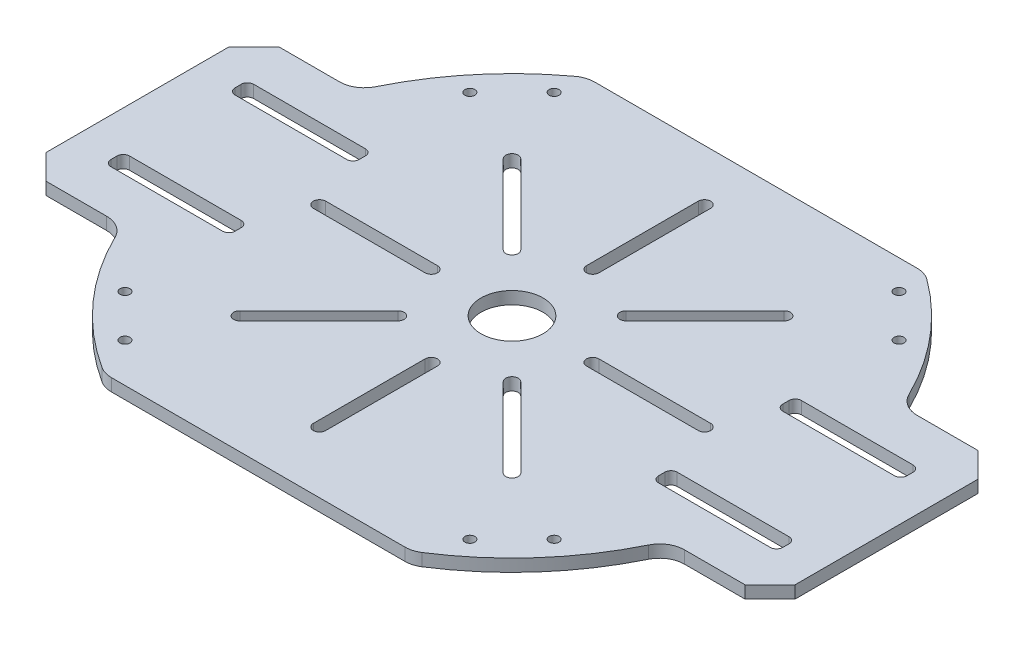
from build123d import *

# Parameters (mm, degrees)
SKETCH1_R           = 6.35
SKETCH1_R_2         = 1.016
SKETCH1_R_3         = 0.080960071
SKETCH1_R_4         = 0.080960069
SKETCH1_R_5         = 0.080960077
BOSS_EXTRUDE1_DEPTH = 2.54
CUT_EXTRUDE1_DEPTH  = 2.54
CUT_EXTRUDE2_DEPTH  = 2.54


with BuildPart() as part:
    # Sketch1 → Boss-Extrude1 (new body)
    with BuildSketch(Plane(origin=(0, 0, 0), x_dir=(1, 0, 0), z_dir=(0, 1, 0))):
        with BuildLine():
            Line((-32.968194559, 49.876062167), (32.968194559, 49.876062167))
            ThreePointArc((32.968194559, 49.876062167), (34.552819694, 49.622589198), (35.979311114, 48.887464993))
            ThreePointArc((35.979311114, 48.887464993), (46.601053925, 38.895203237), (54.533013494, 26.657935048))
            ThreePointArc((54.533013494, 26.657935048), (56.406830639, 24.579655731), (59.096893531, 23.808943565))
            Line((59.096893531, 23.808943565), (71.51687593, 23.808943565))
            Line((71.51687593, 23.808943565), (76.59687593, 18.728943565))
            Line((76.59687593, 18.728943565), (76.59687593, -18.728943565))
            Line((76.59687593, -18.728943565), (71.51687593, -23.808943565))
            Line((71.51687593, -23.808943565), (59.096893531, -23.808943565))
            ThreePointArc((59.096893531, -23.808943565), (56.406830639, -24.579655731), (54.533013494, -26.657935048))
            ThreePointArc((54.533013494, -26.657935048), (45.317367474, -40.383551936), (32.740019521, -51.113463818))
            ThreePointArc((32.740019521, -51.113463818), (31.427532558, -51.711066727), (30, -51.915766654))
            Line((30, -51.915766654), (-30, -51.915766654))
            ThreePointArc((-30, -51.915766654), (-31.427532558, -51.711066727), (-32.740019521, -51.113463818))
            ThreePointArc((-32.740019521, -51.113463818), (-45.317367474, -40.383551936), (-54.533013494, -26.657935048))
            ThreePointArc((-54.533013494, -26.657935048), (-56.406830639, -24.579655731), (-59.096893531, -23.808943565))
            Line((-59.096893531, -23.808943565), (-71.51687407, -23.808943565))
            Line((-71.51687407, -23.808943565), (-76.59687407, -18.728943565))
            Line((-76.59687407, -18.728943565), (-76.59687407, 18.7325))
            Line((-76.59687407, 18.7325), (-71.51687407, 23.8125))
            Line((-71.51687407, 23.8125), (-59.09515487, 23.8125))
            ThreePointArc((-59.09515487, 23.8125), (-56.405221646, 24.583131223), (-54.531409104, 26.661216829))
            ThreePointArc((-54.531409104, 26.661216829), (-46.599883535, 38.896605459), (-35.979311114, 48.887464993))
            ThreePointArc((-35.979311114, 48.887464993), (-34.552819694, 49.622589198), (-32.968194559, 49.876062167))
        make_face()
        with Locations(Location((0, 0, 0), (0, 0, 270))):
            Circle(SKETCH1_R, mode=Mode.SUBTRACT)
        with Locations(Location((43.894926132, 35.273880181, 0), (0, 0, 270))):
            Circle(SKETCH1_R_2, mode=Mode.SUBTRACT)
        with Locations(Location((35.273880264, 43.894926065, 0), (0, 0, 90))):
            Circle(SKETCH1_R_2, mode=Mode.SUBTRACT)
        with Locations(Location((26.694927502, 26.694927451, 0), (0, 0, 270))):
            Circle(SKETCH1_R_3, mode=Mode.SUBTRACT)
        with Locations(Location((26.694927534, -26.694927601, 0), (0, 0, 270))):
            Circle(SKETCH1_R_3, mode=Mode.SUBTRACT)
        with Locations(Location((43.894926149, -35.273880364, 0), (0, 0, 90))):
            Circle(SKETCH1_R_2, mode=Mode.SUBTRACT)
        with Locations(Location((35.273880264, -43.894926232, 0), (0, 0, 270))):
            Circle(SKETCH1_R_2, mode=Mode.SUBTRACT)
        with Locations(Location((-26.694927518, -26.694927634, 0), (0, 0, 270))):
            Circle(SKETCH1_R_4, mode=Mode.SUBTRACT)
        with Locations(Location((-35.27388028, -43.894926248, 0), (0, 0, 90))):
            Circle(SKETCH1_R_2, mode=Mode.SUBTRACT)
        with Locations(Location((-43.894926149, -35.273880364, 0), (0, 0, 270))):
            Circle(SKETCH1_R_2, mode=Mode.SUBTRACT)
        with Locations(Location((-26.694927551, 26.694927419, 0), (0, 0, 270))):
            Circle(SKETCH1_R_5, mode=Mode.SUBTRACT)
        with Locations(Location((-43.894926165, 35.273880181, 0), (0, 0, 90))):
            Circle(SKETCH1_R_2, mode=Mode.SUBTRACT)
        with Locations(Location((-35.27388028, 43.894926049, 0), (0, 0, 270))):
            Circle(SKETCH1_R_2, mode=Mode.SUBTRACT)
    extrude(amount=BOSS_EXTRUDE1_DEPTH)

    # Sketch3 → Cut-Extrude1 (cut)
    with BuildSketch(Plane(origin=(0, 2.54, 0), x_dir=(1, 0, 0), z_dir=(0, 1, 0))):
        with BuildLine():
            Line((10.776307345, 12.572358569), (26.940768363, 28.736819587))
            ThreePointArc((26.940768363, 28.736819587), (28.736819587, 28.736819587), (28.736819587, 26.940768363))
            Line((28.736819587, 26.940768363), (12.572358569, 10.776307345))
            ThreePointArc((12.572358569, 10.776307345), (10.776307345, 10.776307345), (10.776307345, 12.572358569))
        make_face()
        with BuildLine():
            Line((16.51, -1.27), (39.37, -1.27))
            ThreePointArc((39.37, -1.27), (40.64, 0), (39.37, 1.27))
            Line((39.37, 1.27), (16.51, 1.27))
            ThreePointArc((16.51, 1.27), (15.24, 0), (16.51, -1.27))
        make_face()
        with BuildLine():
            Line((10.776307345, -12.572358569), (26.940768363, -28.736819587))
            ThreePointArc((26.940768363, -28.736819587), (28.736819587, -28.736819587), (28.736819587, -26.940768363))
            Line((28.736819587, -26.940768363), (12.572358569, -10.776307345))
            ThreePointArc((12.572358569, -10.776307345), (10.776307345, -10.776307345), (10.776307345, -12.572358569))
        make_face()
        with BuildLine():
            Line((-1.27, -16.51), (-1.27, -39.37))
            ThreePointArc((-1.27, -39.37), (0, -40.64), (1.27, -39.37))
            Line((1.27, -39.37), (1.27, -16.51))
            ThreePointArc((1.27, -16.51), (0, -15.24), (-1.27, -16.51))
        make_face()
        with BuildLine():
            Line((-12.572358569, -10.776307345), (-28.736819587, -26.940768363))
            ThreePointArc((-28.736819587, -26.940768363), (-28.736819587, -28.736819587), (-26.940768363, -28.736819587))
            Line((-26.940768363, -28.736819587), (-10.776307345, -12.572358569))
            ThreePointArc((-10.776307345, -12.572358569), (-10.776307345, -10.776307345), (-12.572358569, -10.776307345))
        make_face()
        with BuildLine():
            Line((-16.51, 1.27), (-39.37, 1.27))
            ThreePointArc((-39.37, 1.27), (-40.64, 0), (-39.37, -1.27))
            Line((-39.37, -1.27), (-16.51, -1.27))
            ThreePointArc((-16.51, -1.27), (-15.24, 0), (-16.51, 1.27))
        make_face()
        with BuildLine():
            Line((-10.776307345, 12.572358569), (-26.940768363, 28.736819587))
            ThreePointArc((-26.940768363, 28.736819587), (-28.736819587, 28.736819587), (-28.736819587, 26.940768363))
            Line((-28.736819587, 26.940768363), (-12.572358569, 10.776307345))
            ThreePointArc((-12.572358569, 10.776307345), (-10.776307345, 10.776307345), (-10.776307345, 12.572358569))
        make_face()
        with BuildLine():
            Line((1.27, 16.51), (1.27, 39.37))
            ThreePointArc((1.27, 39.37), (0, 40.64), (-1.27, 39.37))
            Line((-1.27, 39.37), (-1.27, 16.51))
            ThreePointArc((-1.27, 16.51), (0, 15.24), (1.27, 16.51))
        make_face()
    extrude(amount=-CUT_EXTRUDE1_DEPTH, mode=Mode.SUBTRACT)

    # Sketch4 → Cut-Extrude2 (cut)
    with BuildSketch(Plane(origin=(0, 2.54, 0), x_dir=(1, 0, 0), z_dir=(0, 1, 0))):
        with BuildLine():
            Line((44.59287593, 14.605), (67.45287593, 14.605))
            ThreePointArc((67.45287593, 14.605), (68.350901543, 14.233025612), (68.72287593, 13.335))
            Line((68.72287593, 13.335), (68.72287593, 12.065))
            ThreePointArc((68.72287593, 12.065), (68.350901543, 11.166974388), (67.45287593, 10.795))
            Line((67.45287593, 10.795), (44.59287593, 10.795))
            ThreePointArc((44.59287593, 10.795), (43.694850318, 11.166974388), (43.32287593, 12.065))
            Line((43.32287593, 12.065), (43.32287593, 13.335))
            ThreePointArc((43.32287593, 13.335), (43.694850318, 14.233025612), (44.59287593, 14.605))
        make_face()
        with BuildLine():
            Line((68.72287593, -13.335), (68.72287593, -12.065))
            ThreePointArc((68.72287593, -12.065), (68.350901543, -11.166974388), (67.45287593, -10.795))
            Line((67.45287593, -10.795), (44.59287593, -10.795))
            ThreePointArc((44.59287593, -10.795), (43.694850318, -11.166974388), (43.32287593, -12.065))
            Line((43.32287593, -12.065), (43.32287593, -13.335))
            ThreePointArc((43.32287593, -13.335), (43.694850318, -14.233025612), (44.59287593, -14.605))
            Line((44.59287593, -14.605), (67.45287593, -14.605))
            ThreePointArc((67.45287593, -14.605), (68.350901543, -14.233025612), (68.72287593, -13.335))
        make_face()
        with BuildLine():
            Line((-44.59287593, -14.605), (-67.45287593, -14.605))
            ThreePointArc((-67.45287593, -14.605), (-68.350901543, -14.233025612), (-68.72287593, -13.335))
            Line((-68.72287593, -13.335), (-68.72287593, -12.065))
            ThreePointArc((-68.72287593, -12.065), (-68.350901543, -11.166974388), (-67.45287593, -10.795))
            Line((-67.45287593, -10.795), (-44.59287593, -10.795))
            ThreePointArc((-44.59287593, -10.795), (-43.694850318, -11.166974388), (-43.32287593, -12.065))
            Line((-43.32287593, -12.065), (-43.32287593, -13.335))
            ThreePointArc((-43.32287593, -13.335), (-43.694850318, -14.233025612), (-44.59287593, -14.605))
        make_face()
        with BuildLine():
            Line((-68.72287593, 13.335), (-68.72287593, 12.065))
            ThreePointArc((-68.72287593, 12.065), (-68.350901543, 11.166974388), (-67.45287593, 10.795))
            Line((-67.45287593, 10.795), (-44.59287593, 10.795))
            ThreePointArc((-44.59287593, 10.795), (-43.694850318, 11.166974388), (-43.32287593, 12.065))
            Line((-43.32287593, 12.065), (-43.32287593, 13.335))
            ThreePointArc((-43.32287593, 13.335), (-43.694850318, 14.233025612), (-44.59287593, 14.605))
            Line((-44.59287593, 14.605), (-67.45287593, 14.605))
            ThreePointArc((-67.45287593, 14.605), (-68.350901543, 14.233025612), (-68.72287593, 13.335))
        make_face()
    extrude(amount=-CUT_EXTRUDE2_DEPTH, mode=Mode.SUBTRACT)


solid = part.part
